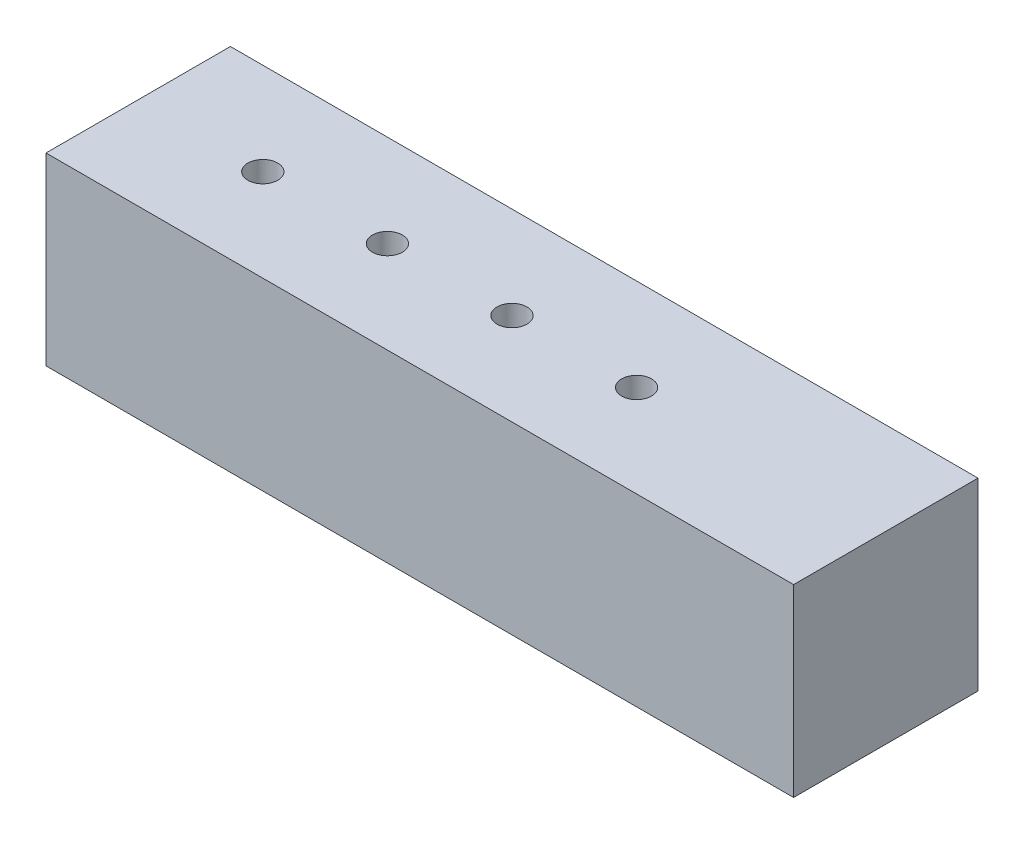
from build123d import *

# Parameters (mm, degrees)
SKETCH1_W           = 150
SKETCH1_H           = 37
BOSS_EXTRUDE1_DEPTH = 37
SKETCH3_R           = 3
CUT_EXTRUDE1_DEPTH  = 37


with BuildPart() as part:
    # Sketch1 → Boss-Extrude1 (new body)
    with BuildSketch(Plane(origin=(0, 0, 0), x_dir=(1, 0, 0), z_dir=(0, 1, 0))):
        Rectangle(SKETCH1_W, SKETCH1_H)
    extrude(amount=BOSS_EXTRUDE1_DEPTH)

    # Sketch3 → Cut-Extrude1 (cut)
    with BuildSketch(Plane(origin=(0, 37, 0), x_dir=(1, 0, 0), z_dir=(0, 1, 0))):
        with Locations((-50, 0)):
            Circle(SKETCH3_R)
        with Locations((-25, 0)):
            Circle(SKETCH3_R)
        Circle(SKETCH3_R)
        with Locations((25, 0)):
            Circle(SKETCH3_R)
    extrude(amount=-CUT_EXTRUDE1_DEPTH, mode=Mode.SUBTRACT)


solid = part.part
